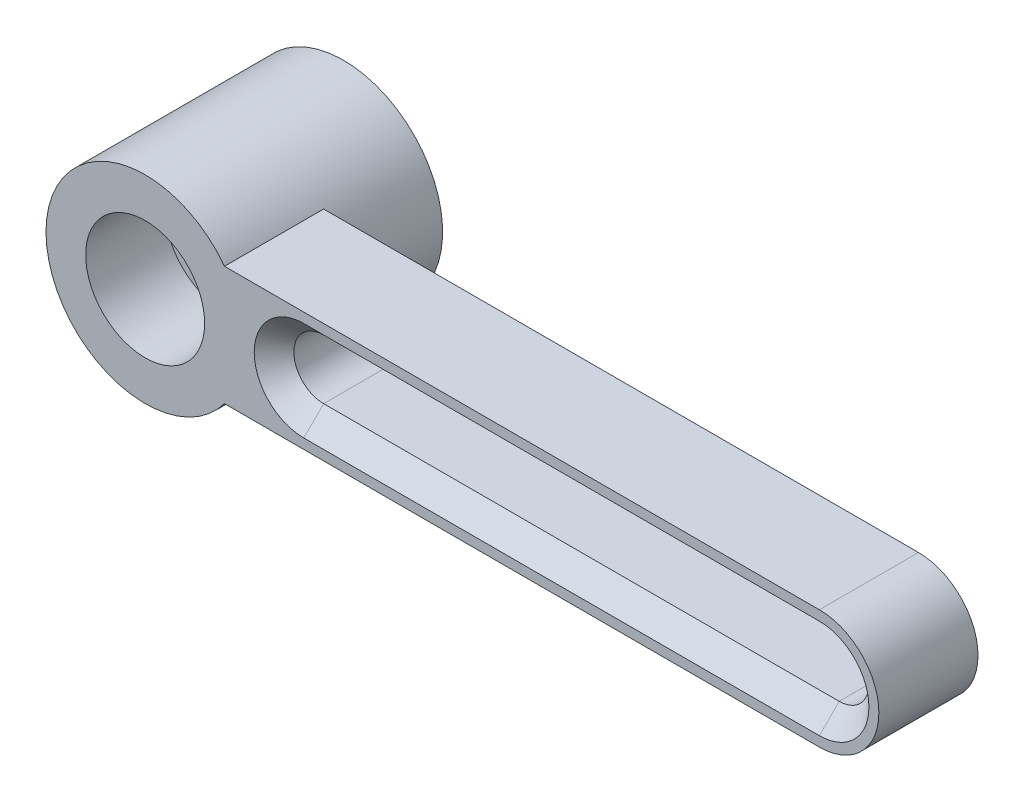
from build123d import *

# Parameters (mm, degrees)
SKETCH_1_W          = 40
SKETCH_1_H          = 6
EXTRUDE_1_DEPTH     = 5
SKETCH_3_R          = 3
EXTRUDE_2_DEPTH     = 5
CUT_EXTRUDE_1_DEPTH = 21.832666656
FILLET_1_RADIUS     = 3
FILLET_1_LENGTH     = 5
SKETCH_5_R          = 1.5
CUT_EXTRUDE_2_DEPTH = 23.561028345
SKETCH_6_R          = 2.5
CUT_EXTRUDE_3_DEPTH = 3
CHAMFER_2_SIZE      = 1
SKETCH_7_R          = 4
EXTRUDE_3_DEPTH     = 10
SKETCH_8_R          = 1.5
CUT_EXTRUDE_4_DEPTH = 24.600847442
SKETCH_9_R          = 3
CUT_EXTRUDE_5_DEPTH = 2
SKETCH_10_R         = 1.6
CUT_EXTRUDE_6_DEPTH = 24.600847442
EXTRUDE_START       = -10
SKETCH_11_R         = 5
SKETCH_11_R_2       = 1.6
EXTRUDE_4_DEPTH     = 10
SKETCH_12_R         = 3
CUT_EXTRUDE_7_DEPTH = 4


with BuildPart() as part:
    # Эскиз1 → Бобышка-Вытянуть1 (new body)
    with BuildSketch(Plane.XY):
        Rectangle(SKETCH_1_W, SKETCH_1_H)
    extrude(amount=EXTRUDE_1_DEPTH)

    # Эскиз3 → Бобышка-Вытянуть2 (add)
    with BuildSketch(Plane(origin=(0, 0, 0), x_dir=(-1, 0, 0), z_dir=(0, 0, -1))):
        with Locations((17, 0)):
            Circle(SKETCH_3_R)
    extrude(amount=EXTRUDE_2_DEPTH)

    # Эскиз4 → Вырез-Вытянуть1 (cut, through all)
    with BuildSketch(Plane(origin=(0, 0, 0), x_dir=(-1, 0, 0), z_dir=(0, 0, -1))):
        with BuildLine():
            Line((20, 3), (17, 3))
            ThreePointArc((17, 3), (19.121320344, 2.121320344), (20, 0))
            Line((20, 0), (20, 3))
        make_face()
        with BuildLine():
            Line((20, -3), (20, 0))
            ThreePointArc((20, 0), (19.121320344, -2.121320344), (17, -3))
            Line((17, -3), (20, -3))
        make_face()
    extrude(amount=-CUT_EXTRUDE_1_DEPTH, mode=Mode.SUBTRACT)

    # Скругление1: full round fillet: the end face becomes a half cylinder, R = half its width
    fillet_1_face = Plane((20, 0, 2.5), x_dir=(0, 0, -1), z_dir=(1, 0, 0))  # on the end face: x along it, z out of the body
    fillet_1_slab = fillet_1_face.offset(-FILLET_1_RADIUS / 2) * Box(FILLET_1_LENGTH, 2 * FILLET_1_RADIUS, FILLET_1_RADIUS, mode=Mode.PRIVATE)  # the body's end, R deep
    fillet_1_round = Plane((17, 0, 2.5), x_dir=(1, 0, 0), z_dir=(0, 0, -1)) * Cylinder(FILLET_1_RADIUS, FILLET_1_LENGTH, mode=Mode.PRIVATE)  # its axis R under the face
    add(fillet_1_slab - fillet_1_round, mode=Mode.SUBTRACT)

    # Эскиз5 → Вырез-Вытянуть2 (cut, through all)
    with BuildSketch(Plane.XY.offset(5)):
        with Locations((-17, 0)):
            Circle(SKETCH_5_R)
        with BuildLine():
            Line((-9, 1.5), (17, 1.5))
            ThreePointArc((17, 1.5), (18.5, 0), (17, -1.5))
            Line((17, -1.5), (-9, -1.5))
            ThreePointArc((-9, -1.5), (-10.5, 0), (-9, 1.5))
        make_face()
    extrude(amount=-CUT_EXTRUDE_2_DEPTH, mode=Mode.SUBTRACT)

    # Эскиз6 → Вырез-Вытянуть3 (cut)
    with BuildSketch(Plane.XY.offset(5)):
        with Locations((-17, 0)):
            Circle(SKETCH_6_R)
    extrude(amount=-CUT_EXTRUDE_3_DEPTH, mode=Mode.SUBTRACT)

    # Фаска2
    chamfer_2_edges = [part.edges().sort_by_distance(p)[0] for p in [
        (4, -1.5, 0),
        (18.5, 0, 0),
        (4, 1.5, 0),
        (-10.5, 0, 0),
        (4, 1.5, 5),
        (-10.5, 0, 5),
        (4, -1.5, 5),
        (18.5, 0, 5),
    ]]
    chamfer(chamfer_2_edges, length=CHAMFER_2_SIZE)

    # Эскиз7 → Бобышка-Вытянуть3 (add)
    with BuildSketch(Plane.XY.offset(5)):
        with Locations((-17, 0)):
            Circle(SKETCH_7_R)
    extrude(amount=-EXTRUDE_3_DEPTH)

    # Эскиз8 → Вырез-Вытянуть4 (cut, through all)
    with BuildSketch(Plane.XY.offset(5)):
        with Locations((-17, 0)):
            Circle(SKETCH_8_R)
    extrude(amount=-CUT_EXTRUDE_4_DEPTH, mode=Mode.SUBTRACT)

    # Эскиз9 → Вырез-Вытянуть5 (cut)
    with BuildSketch(Plane.XY.offset(5)):
        with Locations((-17, 0)):
            Circle(SKETCH_9_R)
    extrude(amount=-CUT_EXTRUDE_5_DEPTH, mode=Mode.SUBTRACT)

    # Эскиз10 → Вырез-Вытянуть6 (cut, through all)
    with BuildSketch(Plane.XY.offset(5)):
        with Locations((-17, 0)):
            Circle(SKETCH_10_R)
    extrude(amount=-CUT_EXTRUDE_6_DEPTH, mode=Mode.SUBTRACT)

    # Эскиз11 → Бобышка-Вытянуть4 (add)
    with BuildSketch(Plane(origin=(0, 0, -5), x_dir=(-1, 0, 0), z_dir=(0, 0, -1)).offset(EXTRUDE_START)):
        with Locations((17, 0)):
            Circle(SKETCH_11_R)
        with Locations(Location((17, 0, 0), (0, 0, 180))):
            Circle(SKETCH_11_R_2, mode=Mode.SUBTRACT)
    extrude(amount=EXTRUDE_4_DEPTH)

    # Эскиз12 → Вырез-Вытянуть7 (cut)
    with BuildSketch(Plane.XY.offset(5)):
        with Locations((-17, 0)):
            Circle(SKETCH_12_R)
    extrude(amount=-CUT_EXTRUDE_7_DEPTH, mode=Mode.SUBTRACT)


solid = part.part
